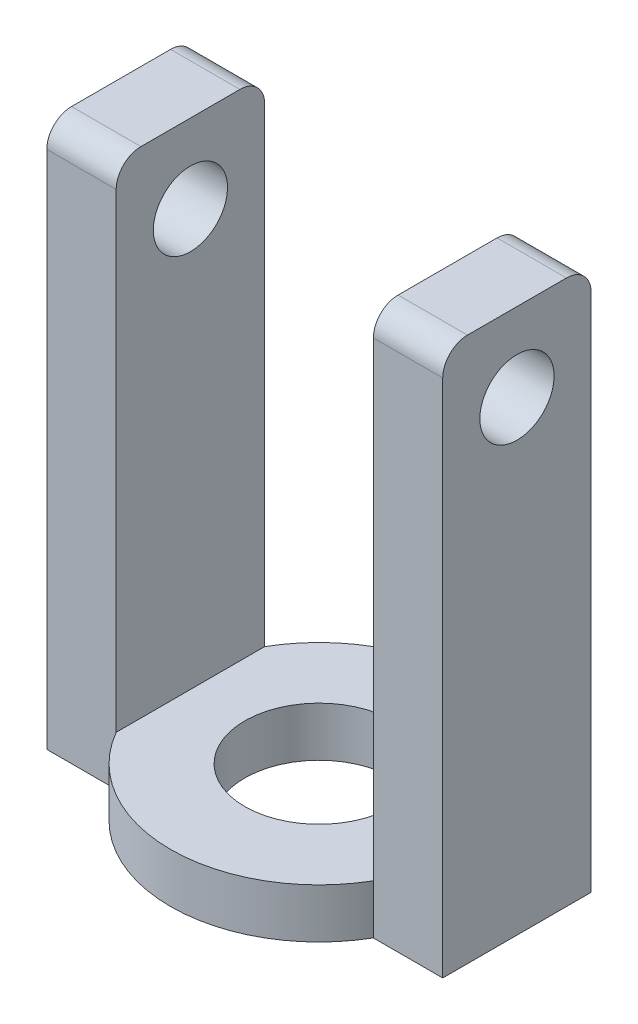
from build123d import *

# Parameters (mm, degrees)
BOSS_EXTRUDE1_DEPTH = 100
SKETCH2_W           = 140.192378865
SKETCH2_H           = 300
BOSS_EXTRUDE2_DEPTH = 1000
SKETCH3_R           = 150
CUT_EXTRUDE1_DEPTH  = 100
FILLET1_R           = 50
CUT_EXTRUDE2_START  = -800
SKETCH4_R           = 75
CUT_EXTRUDE2_DEPTH  = 800


with BuildPart() as part:
    # Sketch1 → Boss-Extrude1 (new body)
    with BuildSketch(Plane(origin=(0, 0, 0), x_dir=(1, 0, 0), z_dir=(0, 1, 0))):
        with BuildLine():
            ThreePointArc((259.807621135, 150), (0, 300), (-259.807621135, 150))
            Line((-259.807621135, 150), (259.807621135, 150))
        make_face()
        with BuildLine():
            Line((259.807621135, 150), (-259.807621135, 150))
            ThreePointArc((-259.807621135, 150), (-300, 0), (-259.807621135, -150))
            Line((-259.807621135, -150), (259.807621135, -150))
            ThreePointArc((259.807621135, -150), (289.777747887, -77.645713531), (300, 0))
            ThreePointArc((300, 0), (289.777747887, 77.645713531), (259.807621135, 150))
        make_face()
        with BuildLine():
            Line((259.807621135, -150), (-259.807621135, -150))
            ThreePointArc((-259.807621135, -150), (0, -300), (259.807621135, -150))
        make_face()
        with BuildLine():
            Line((-259.807621135, 150), (-400, 150))
            Line((-400, 150), (-400, -150))
            Line((-400, -150), (-259.807621135, -150))
            ThreePointArc((-259.807621135, -150), (-300, 0), (-259.807621135, 150))
        make_face()
        with BuildLine():
            Line((400, 150), (259.807621135, 150))
            ThreePointArc((259.807621135, 150), (289.777747887, 77.645713531), (300, 0))
            ThreePointArc((300, 0), (289.777747887, -77.645713531), (259.807621135, -150))
            Line((259.807621135, -150), (400, -150))
            Line((400, -150), (400, 150))
        make_face()
    extrude(amount=BOSS_EXTRUDE1_DEPTH)

    # Sketch2 → Boss-Extrude2 (add)
    with BuildSketch(Plane(origin=(0, 100, 0), x_dir=(1, 0, 0), z_dir=(0, 1, 0))):
        with Locations((-329.903810568, 0)):
            Rectangle(SKETCH2_W, SKETCH2_H)
        with Locations((329.903810568, 0)):
            Rectangle(SKETCH2_W, SKETCH2_H)
    extrude(amount=BOSS_EXTRUDE2_DEPTH)

    # Sketch3 → Cut-Extrude1 (cut)
    with BuildSketch(Plane(origin=(0, 100, 0), x_dir=(1, 0, 0), z_dir=(0, 1, 0))):
        with Locations(Location((0, 0, 0), (0, 0, 270))):
            Circle(SKETCH3_R)
    extrude(amount=-CUT_EXTRUDE1_DEPTH, mode=Mode.SUBTRACT)

    # Fillet1
    fillet1_edges = [part.edges().sort_by_distance(p)[0] for p in [
        (-329.903810568, 1100, -150),
        (-329.903810568, 1100, 150),
        (329.903810568, 1100, -150),
        (329.903810568, 1100, 150),
    ]]
    fillet(fillet1_edges, radius=FILLET1_R)

    # Sketch4 → Cut-Extrude2 (cut)
    with BuildSketch(Plane.ZY.offset(400).offset(CUT_EXTRUDE2_START)):
        with Locations((0, 941.064540291)):
            Circle(SKETCH4_R)
    extrude(amount=CUT_EXTRUDE2_DEPTH, mode=Mode.SUBTRACT)


solid = part.part
